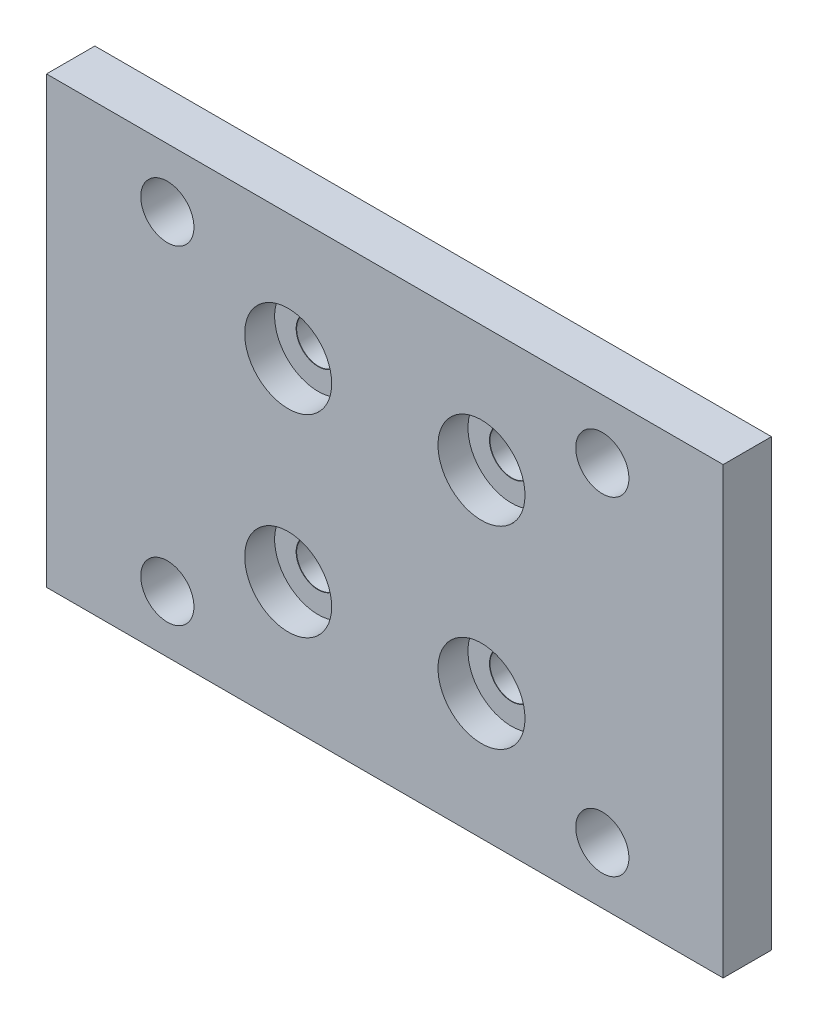
from build123d import *

# Parameters (mm, degrees)
ESQUISSE1_W                                = 70
ESQUISSE1_H                                = 46
BOSS_EXTRU_1_DEPTH                         = 5
D_GAGEMENT_M51_D                           = 5.5
D_GAGEMENT_M41_D                           = 4.5
CHAMBRAGE_POUR_VIS_T_TE_RONDE_BOMB_2_COUNT = 2
CHAMBRAGE_POUR_VIS_T_TE_RONDE_BOMB_2_PITCH = 20
CHAMBRAGE_POUR_VIS_T_TE_RONDE_BOMB_3_COUNT = 2
CHAMBRAGE_POUR_VIS_T_TE_RONDE_BOMB_3_PITCH = 28.284271247
CHAMBRAGE_POUR_VIS_T_TE_RONDE_BOMB_4_COUNT = 2
CHAMBRAGE_POUR_VIS_T_TE_RONDE_BOMB_4_PITCH = 20


with BuildPart() as part:
    # Esquisse1 → Boss.-Extru.1 (new body)
    with BuildSketch(Plane.XY):
        Rectangle(ESQUISSE1_W, ESQUISSE1_H)
    extrude(amount=BOSS_EXTRU_1_DEPTH)

    # Dégagement M51 (through all)
    with Locations(Plane.XY.offset(5)):
        with Locations((22.5, -17.116426572), (22.5, 16.883573428), (-22.5, 16.883573428), (-22.5, -17.116426572)):
            Hole(D_GAGEMENT_M51_D / 2)

    # Dégagement M41 (through all)
    with Locations(Plane(origin=(0, 0, 0), x_dir=(-1, 0, 0), z_dir=(0, 0, -1))):
        with Locations((10, -10), (-10, -10), (-10, 10), (10, 10)):
            Hole(D_GAGEMENT_M41_D / 2)

    # Esquisse6 → Chambrage pour vis à tête ronde bombée M41 (revolve, cut)
    with BuildSketch(Plane(origin=(-10, -10, 5), x_dir=(0, -1, 0), z_dir=(1, 0, 0))):
        Polygon((0, 0), (0, 5), (2.25, 5), (2.25, 3.125), (2.275, 3.1), (4.5, 3.1), (4.5, 0), align=None)
    chambrage_pour_vis_t_te_ronde_bomb_e_m = revolve(axis=Axis((-10, -10, 11.35), (0, 0, -1)), mode=Mode.SUBTRACT)

    # Chambrage pour vis _ t_te ronde bomb 2: Chambrage pour vis à tête ronde bombée M41 ×2
    with Locations(*[(0, i * CHAMBRAGE_POUR_VIS_T_TE_RONDE_BOMB_2_PITCH, 0) for i in range(1, CHAMBRAGE_POUR_VIS_T_TE_RONDE_BOMB_2_COUNT)]):
        add(chambrage_pour_vis_t_te_ronde_bomb_e_m, mode=Mode.SUBTRACT)

    # Chambrage pour vis _ t_te ronde bomb 3: Chambrage pour vis à tête ronde bombée M41 ×2
    with Locations(*[Vector(0.7071067811865407, 0.7071067811865545, 0) * (i * CHAMBRAGE_POUR_VIS_T_TE_RONDE_BOMB_3_PITCH) for i in range(1, CHAMBRAGE_POUR_VIS_T_TE_RONDE_BOMB_3_COUNT)]):
        add(chambrage_pour_vis_t_te_ronde_bomb_e_m, mode=Mode.SUBTRACT)

    # Chambrage pour vis _ t_te ronde bomb 4: Chambrage pour vis à tête ronde bombée M41 ×2
    with Locations(*[(i * CHAMBRAGE_POUR_VIS_T_TE_RONDE_BOMB_4_PITCH, 0, 0) for i in range(1, CHAMBRAGE_POUR_VIS_T_TE_RONDE_BOMB_4_COUNT)]):
        add(chambrage_pour_vis_t_te_ronde_bomb_e_m, mode=Mode.SUBTRACT)


solid = part.part
